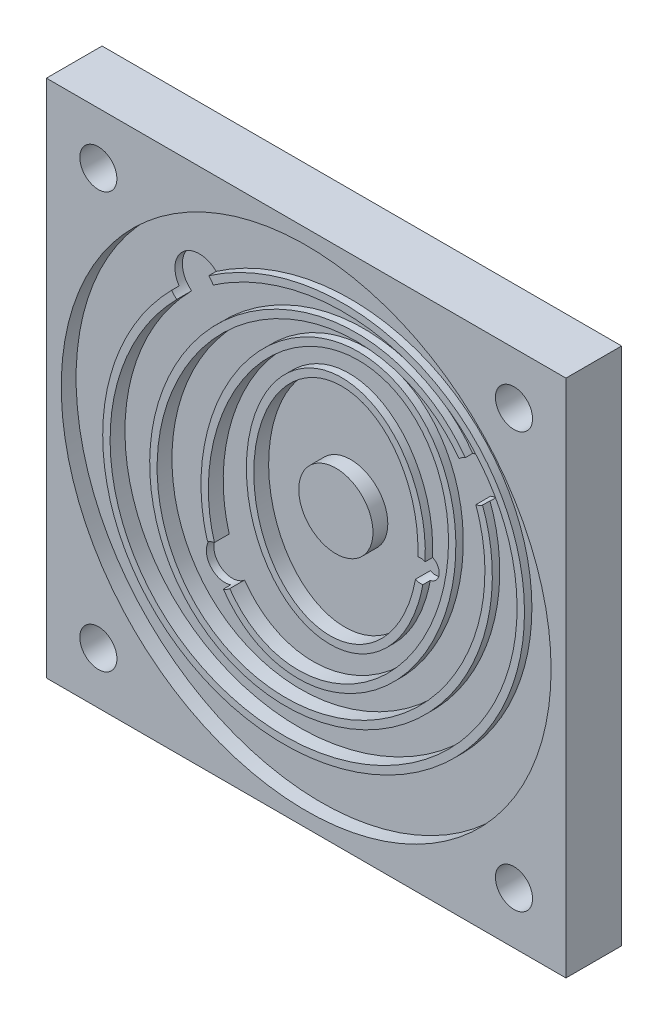
from build123d import *

# Parameters (mm, degrees)
BOSS_EXTRUDE1_DEPTH      = 8.89
BOSS_EXTRUDE1_DEPTH_BACK = 0.635
SKETCH1_W                = 88.9
SKETCH1_H                = 88.9
SKETCH5_RX               = 38.1
SKETCH5_RY               = 33.02
SKETCH5_RX_2             = 36.83
SKETCH5_RY_2             = 31.75
BOSS_EXTRUDE4_DEPTH      = 9.525
SKETCH18_R               = 3.175
CUT_EXTRUDE6_DEPTH       = 5.08
SKETCH41_R               = 41.91
CUT_EXTRUDE7_DEPTH       = 2.54
CUT_EXTRUDE8_DEPTH       = 3.81
CUT_EXTRUDE9_DEPTH       = 5.08
CUT_EXTRUDE10_DEPTH      = 6.35
SKETCH45_R               = 6.35
CUT_EXTRUDE11_DEPTH      = 7.62
SKETCH46_R               = 4.167251
CUT_EXTRUDE12_DEPTH      = 3.81
SKETCH47_R               = 3.175
CUT_EXTRUDE13_DEPTH      = 5.08
SKETCH49_R               = 3.175
CUT_EXTRUDE14_DEPTH      = 6.35
SKETCH50_R               = 1.89865
CUT_EXTRUDE15_DEPTH      = 7.62
SKETCH51_RX              = 38.1
SKETCH51_RY              = 33.02
CUT_EXTRUDE16_DEPTH      = 1.27
SKETCH52_RX              = 33.02
SKETCH52_RY              = 26.67
CUT_EXTRUDE19_DEPTH      = 2.54
SKETCH53_RX              = 27.94
SKETCH53_RY              = 20.32
CUT_EXTRUDE20_DEPTH      = 3.81
SKETCH54_RX              = 20.32
SKETCH54_RY              = 15.24
CUT_EXTRUDE21_DEPTH      = 5.08


with BuildPart() as part:
    # Sketch1 → Boss-Extrude1 (new, two sides: drawn at the far end of the back side and taken through both)
    with BuildSketch(Plane.XY.offset(-BOSS_EXTRUDE1_DEPTH_BACK)):
        Rectangle(SKETCH1_W, SKETCH1_H)
    extrude(amount=BOSS_EXTRUDE1_DEPTH + BOSS_EXTRUDE1_DEPTH_BACK)

    # Sketch5 → Boss-Extrude4 (add)
    with BuildSketch(Plane(origin=(0, 0, -0.635), x_dir=(-1, 0, 0), z_dir=(0, 0, -1))):
        with Locations(Location((0, 0), (0, 0, 139.970219615))):
            Ellipse(SKETCH5_RX, SKETCH5_RY)
        with Locations(Location((0, 0), (0, 0, -40.029780385))):
            Ellipse(SKETCH5_RX_2, SKETCH5_RY_2, mode=Mode.SUBTRACT)
    extrude(amount=-BOSS_EXTRUDE4_DEPTH)

    # Sketch18 → Cut-Extrude6 (cut)
    with BuildSketch(Plane.XY.offset(8.89)):
        with Locations((-35.56, -35.56)):
            Circle(SKETCH18_R)
        with Locations(Location((35.56, -35.56, 0), (0, 0, 180))):
            Circle(SKETCH18_R)
        with Locations((35.56, 35.56)):
            Circle(SKETCH18_R)
        with Locations(Location((-35.56, 35.56, 0), (0, 0, 180))):
            Circle(SKETCH18_R)
    extrude(amount=-CUT_EXTRUDE6_DEPTH, mode=Mode.SUBTRACT)

    # Sketch41 → Cut-Extrude7 (cut)
    with BuildSketch(Plane.XY.offset(8.89)):
        Circle(SKETCH41_R)
        with BuildLine():
            ThreePointArc((-17.934517351, 27.802131364), (-23.505532411, 27.992087871), (-24.281443344, 22.472101051))
            add(Edge.make_bspline(
                [(-24.281443344, 22.472101051), (-66.865704154, -20.771192371), (-13.443209362, -34.190904112), (39.97928543, -47.610615853), (35.998937704, 7.329690716), (32.018589977, 62.269997284), (-17.934517351, 27.802131364)],
                knots=[4.821234116, 4.821234116, 4.821234116, 6.842973618, 6.842973618, 8.86471312, 8.86471312, 10.886452622, 10.886452622, 10.886452622], degree=2, weights=[1, 0.531123987, 1, 0.531123987, 1, 0.531123987, 1]))
        make_face(mode=Mode.SUBTRACT)
    extrude(amount=-CUT_EXTRUDE7_DEPTH, mode=Mode.SUBTRACT)

    # Sketch42 → Cut-Extrude8 (cut)
    with BuildSketch(Plane.XY.offset(8.89)):
        with BuildLine():
            ThreePointArc((-23.418508607, 21.538529708), (-18.145664536, 21.609632235), (-17.164167238, 26.790810018))
            add(Edge.make_bspline(
                [(-23.418508607, 21.538529708), (-64.458466127, -20.248126473), (-13.030120003, -32.988017824), (38.398226121, -45.727909174), (34.742747797, 7.130753779), (31.087269473, 59.989416731), (-17.164167238, 26.790810018)],
                knots=[4.823355586, 4.823355586, 4.823355586, 6.843680344, 6.843680344, 8.864005103, 8.864005103, 10.884329861, 10.884329861, 10.884329861], degree=2, weights=[1, 0.531723207, 1, 0.531723207, 1, 0.531723207, 1]))
        make_face()
        with BuildLine():
            ThreePointArc((27.643948392, 15.949894531), (28.597022277, 20.019120131), (24.691663207, 21.507447158))
            add(Edge.make_bspline(
                [(24.691663207, 21.507447158), (-0.409183889, 56.288763332), (-24.923990866, 10.452356227), (-49.438797844, -35.384050878), (-3.146518506, -30.542819085), (43.145760832, -25.701587291), (27.643948392, 15.949894531)],
                knots=[6.063056352, 6.063056352, 6.063056352, 8.080802501, 8.080802501, 10.09854865, 10.09854865, 12.1162948, 12.1162948, 12.1162948], degree=2, weights=[1, 0.5328147, 1, 0.5328147, 1, 0.5328147, 1]))
        make_face(mode=Mode.SUBTRACT)
    extrude(amount=-CUT_EXTRUDE8_DEPTH, mode=Mode.SUBTRACT)

    # Sketch43 → Cut-Extrude9 (cut)
    with BuildSketch(Plane.XY.offset(8.89)):
        with BuildLine():
            ThreePointArc((23.608517897, 20.833580161), (22.989361941, 17.039750166), (26.480007568, 15.429814379))
            add(Edge.make_bspline(
                [(23.608517897, 20.833580161), (-0.393903695, 53.813605079), (-23.832711178, 9.794842107), (-47.271518662, -34.223920865), (-3.072232891, -29.27364674), (41.127052879, -24.323372615), (26.480007568, 15.429814379)],
                knots=[2.925642489, 2.925642489, 2.925642489, 4.941864869, 4.941864869, 6.958087248, 6.958087248, 8.974309627, 8.974309627, 8.974309627], degree=2, weights=[1, 0.533459276, 1, 0.533459276, 1, 0.533459276, 1]))
        make_face()
        with BuildLine():
            ThreePointArc((-20.685153013, -14.252817534), (-21.857242594, -18.29585271), (-17.985886025, -19.948888021))
            add(Edge.make_bspline(
                [(-17.985886025, -19.948888021), (1.246366259, -47.855965667), (18.711961294, -7.929781595), (36.177556329, 31.996402477), (2.363407813, 26.569404077), (-31.450740703, 21.142405677), (-20.685153013, -14.252817534)],
                knots=[5.870354275, 5.870354275, 5.870354275, 7.871783834, 7.871783834, 9.873213393, 9.873213393, 11.874642952, 11.874642952, 11.874642952], degree=2, weights=[1, 0.539700702, 1, 0.539700702, 1, 0.539700702, 1]))
        make_face(mode=Mode.SUBTRACT)
    extrude(amount=-CUT_EXTRUDE9_DEPTH, mode=Mode.SUBTRACT)

    # Sketch44 → Cut-Extrude10 (cut)
    with BuildSketch(Plane.XY.offset(8.89)):
        with BuildLine():
            ThreePointArc((-16.890214155, -19.319389053), (-16.120530718, -15.573239404), (-19.511416305, -13.804639755))
            add(Edge.make_bspline(
                [(-16.890214155, -19.319389053), (1.30940415, -45.285437384), (17.656199499, -7.172035557), (34.002994848, 30.94136627), (2.235134814, 25.272354759), (-29.532725219, 19.603343249), (-19.511416305, -13.804639755)],
                knots=[5.883428871, 5.883428871, 5.883428871, 7.882181502, 7.882181502, 9.880934133, 9.880934133, 11.879686763, 11.879686763, 11.879686763], degree=2, weights=[1, 0.540827013, 1, 0.540827013, 1, 0.540827013, 1]))
        make_face()
        with BuildLine():
            ThreePointArc((14.883705367, -3.487933181), (16.40110548, -1.836900203), (15.286546447, 0.108908411))
            add(Edge.make_bspline(
                [(15.286546447, 0.108908411), (16.749853113, 32.916009757), (-6.034948014, 18.071890086), (-28.81974914, 3.227770415), (-9.883325669, -16.289066349), (9.053097802, -35.805903114), (14.883705367, -3.487933181)],
                knots=[1.659972794, 1.659972794, 1.659972794, 3.694916918, 3.694916918, 5.729861042, 5.729861042, 7.764805166, 7.764805166, 7.764805166], degree=2, weights=[1, 0.525518353, 1, 0.525518353, 1, 0.525518353, 1]))
        make_face(mode=Mode.SUBTRACT)
    extrude(amount=-CUT_EXTRUDE10_DEPTH, mode=Mode.SUBTRACT)

    # Sketch45 → Cut-Extrude11 (cut)
    with BuildSketch(Plane.XY.offset(8.89)):
        with BuildLine():
            ThreePointArc((14.020008766, 0.20761712), (12.627399794, -1.414250599), (13.626711584, -3.304009999))
            add(Edge.make_bspline(
                [(14.020008766, 0.20761712), (15.349662677, 30.873444464), (-5.50789457, 16.913168556), (-26.365451818, 2.952892648), (-9.112995896, -15.275649872), (8.139460026, -33.504192392), (13.626711584, -3.304009999)],
                knots=[1.66367476, 1.66367476, 1.66367476, 3.696150907, 3.696150907, 5.728627054, 5.728627054, 7.761103201, 7.761103201, 7.761103201], degree=2, weights=[1, 0.526567808, 1, 0.526567808, 1, 0.526567808, 1]))
        make_face()
        Circle(SKETCH45_R, mode=Mode.SUBTRACT)
    extrude(amount=-CUT_EXTRUDE11_DEPTH, mode=Mode.SUBTRACT)

    # Sketch46 → Cut-Extrude12 (cut)
    with BuildSketch(Plane.XY.offset(8.89)):
        with Locations((-20.825598599, 24.800859947)):
            Circle(SKETCH46_R)
    extrude(amount=-CUT_EXTRUDE12_DEPTH, mode=Mode.SUBTRACT)

    # Sketch47 → Cut-Extrude13 (cut)
    with BuildSketch(Plane.XY.offset(8.89)):
        with Locations((25.793095452, 18.529617074)):
            Circle(SKETCH47_R)
    extrude(amount=-CUT_EXTRUDE13_DEPTH, mode=Mode.SUBTRACT)

    # Sketch49 → Cut-Extrude14 (cut)
    with BuildSketch(Plane.XY.offset(8.89)):
        with Locations((-18.988094875, -16.936214388)):
            Circle(SKETCH49_R)
    extrude(amount=-CUT_EXTRUDE14_DEPTH, mode=Mode.SUBTRACT)

    # Sketch50 → Cut-Extrude15 (cut)
    with BuildSketch(Plane.XY.offset(8.89)):
        with Locations((14.514252637, -1.625575401)):
            Circle(SKETCH50_R)
    extrude(amount=-CUT_EXTRUDE15_DEPTH, mode=Mode.SUBTRACT)

    # Sketch51 → Cut-Extrude16 (cut)
    with BuildSketch(Plane.XY.offset(8.89)):
        with Locations(Location((0, 0), (0, 0, -139.970219615))):
            Ellipse(SKETCH51_RX, SKETCH51_RY)
    extrude(amount=-CUT_EXTRUDE16_DEPTH, mode=Mode.SUBTRACT)

    # Sketch52 → Cut-Extrude19 (cut)
    with BuildSketch(Plane.XY.offset(8.89)):
        with Locations(Location((0, 0), (0, 0, -128.698597153))):
            Ellipse(SKETCH52_RX, SKETCH52_RY)
    extrude(amount=-CUT_EXTRUDE19_DEPTH, mode=Mode.SUBTRACT)

    # Sketch53 → Cut-Extrude20 (cut)
    with BuildSketch(Plane.XY.offset(8.89)):
        with Locations(Location((0, 0), (0, 0, -114.368684081))):
            Ellipse(SKETCH53_RX, SKETCH53_RY)
    extrude(amount=-CUT_EXTRUDE20_DEPTH, mode=Mode.SUBTRACT)

    # Sketch54 → Cut-Extrude21 (cut)
    with BuildSketch(Plane.XY.offset(8.89)):
        with Locations(Location((0, 0), (0, 0, -96.390413854))):
            Ellipse(SKETCH54_RX, SKETCH54_RY)
    extrude(amount=-CUT_EXTRUDE21_DEPTH, mode=Mode.SUBTRACT)


solid = part.part
